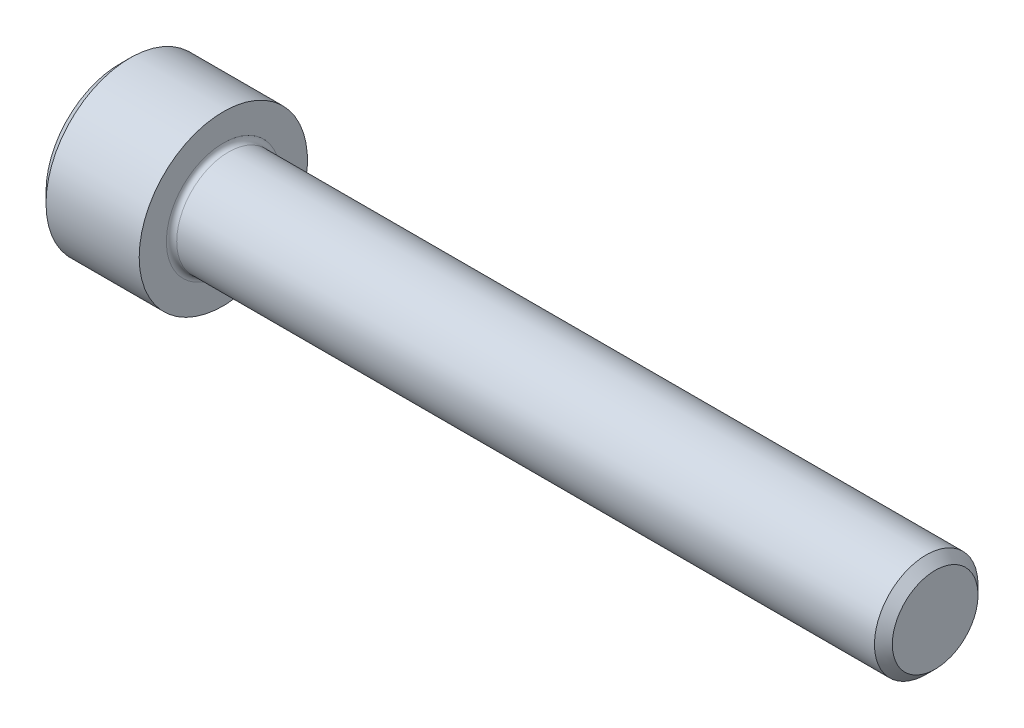
from build123d import *

# Parameters (mm, degrees)
FILLET1_R   = 0.4
HEX_2_DEPTH = 4


with BuildPart() as part:
    # BodySke → Base-Revolve (revolve)
    with BuildSketch(Plane.XY, mode=Mode.PRIVATE) as base_revolve_sk:
        Polygon((0, 0), (0, 5.7), (0.8, 6.5), (8, 6.5), (8, 4), (62.3095, 4), (63, 3.3095), (63, 0), align=None)
    revolve(base_revolve_sk.sketch.rotate(Axis((-31.75, 0, 0), (1, 0, 0)), 90), axis=Axis((-31.75, 0, 0), (1, 0, 0)))

    # Fillet1
    fillet1_edges = [part.edges().sort_by_distance(p)[0] for p in [
        (8, 0, -4),
    ]]
    fillet(fillet1_edges, radius=FILLET1_R)

    # Sketch2 → Hex-PreBroach (revolve, cut)
    with BuildSketch(Plane.XY, mode=Mode.PRIVATE) as hex_prebroach_sk:
        Polygon((0, 3.0475), (4, 3.0475), (5.759474945, 0), (0, 0), align=None)
    revolve(hex_prebroach_sk.sketch.rotate(Axis((0, 0, 0), (1, 0, 0)), 90), axis=Axis((0, 0, 0), (1, 0, 0)), mode=Mode.SUBTRACT)

    # Sketch3 → Hex 2 (cut)
    with BuildSketch(Plane(origin=(0, 0, 0), x_dir=(0, 0.500000000000001, 0.866025403784438), z_dir=(-1, 0, 0))):
        Polygon((1.759474945, 3.0475), (-1.759474945, 3.0475), (-3.518949891, 0), (-1.759474945, -3.0475), (1.759474945, -3.0475), (3.518949891, 0), align=None)
    extrude(amount=-HEX_2_DEPTH, mode=Mode.SUBTRACT)


solid = part.part
